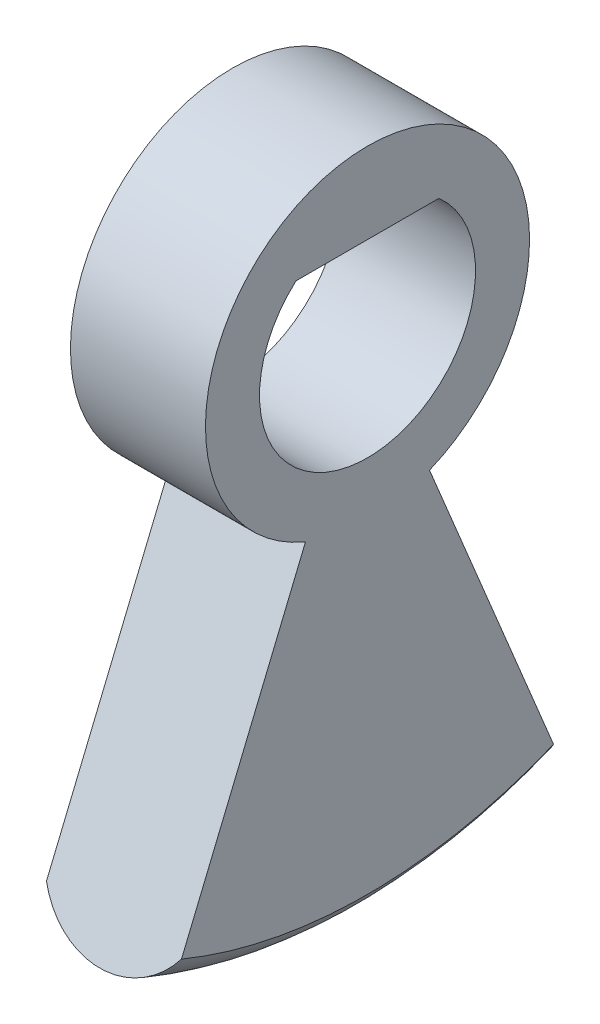
from build123d import *

# Parameters (mm, degrees)
CUT_EXTRUDE1_DEPTH           = 10
CUT_REVOLVE1_ANGLE           = 157.5
CUT_REVOLVE1_OTHER_WAY_ANGLE = 157.5


with BuildPart() as part:
    # Sketch3 → Revolve1 (revolve)
    with BuildSketch(Plane.XY, mode=Mode.PRIVATE) as revolve1_sk:
        with BuildLine():
            Line((1.25, 0), (1.25, 9))
            ThreePointArc((1.25, 9), (0, 9.690197618), (-1.25, 9))
            Line((-1.25, 9), (-1.25, 0))
            Line((-1.25, 0), (1.25, 0))
        make_face()
    revolve(revolve1_sk.sketch.rotate(Axis((-1.25, 0, 0), (1, 0, 0)), 180), axis=Axis((-1.25, 0, 0), (1, 0, 0)))

    # Sketch4 → Cut-Extrude1 (cut)
    # profile 1 of 2: a face of its own
    with BuildSketch(Plane(origin=(1.25, 0, 0), x_dir=(0, 0, -1), z_dir=(1, 0, 0))):
        with BuildLine():
            Line((1.322875656, 1.5), (-1.322875656, 1.5))
            ThreePointArc((-1.322875656, 1.5), (0, -2), (1.322875656, 1.5))
        make_face()
        with BuildLine():
            ThreePointArc((-1.118033989, 1), (0, -1.5), (1.118033989, 1))
            Line((1.118033989, 1), (-1.118033989, 1))
        make_face(mode=Mode.SUBTRACT)
    # profile 2 of 2: a face of its own
    with BuildSketch(Plane(origin=(1.25, 0, 0), x_dir=(0, 0, -1), z_dir=(1, 0, 0))):
        with BuildLine():
            Line((1.118033989, 1), (-1.118033989, 1))
            ThreePointArc((-1.118033989, 1), (0, -1.5), (1.118033989, 1))
        make_face()
    extrude(amount=-CUT_EXTRUDE1_DEPTH, mode=Mode.SUBTRACT)

    # Sketch7 → Cut-Revolve1 (revolve, cut)
    with BuildSketch(Plane.XY):
        with BuildLine():
            ThreePointArc((-1.25, 9), (0, 9.690197618), (1.25, 9))
            Line((1.25, 9), (1.25, 3))
            Line((1.25, 3), (-1.25, 3))
            Line((-1.25, 3), (-1.25, 9))
        make_face()
    revolve(axis=Axis((-1.25, 0, 0), (1, 0, 0)), revolution_arc=CUT_REVOLVE1_ANGLE, mode=Mode.SUBTRACT)

    # Sketch7 → Cut-Revolve1 other way (revolve, cut)
    with BuildSketch(Plane.XY):
        with BuildLine():
            ThreePointArc((-1.25, 9), (0, 9.690197618), (1.25, 9))
            Line((1.25, 9), (1.25, 3))
            Line((1.25, 3), (-1.25, 3))
            Line((-1.25, 3), (-1.25, 9))
        make_face()
    revolve(axis=Axis((-1.25, 0, 0), (-1, 0, 0)), revolution_arc=CUT_REVOLVE1_OTHER_WAY_ANGLE, mode=Mode.SUBTRACT)


solid = part.part
